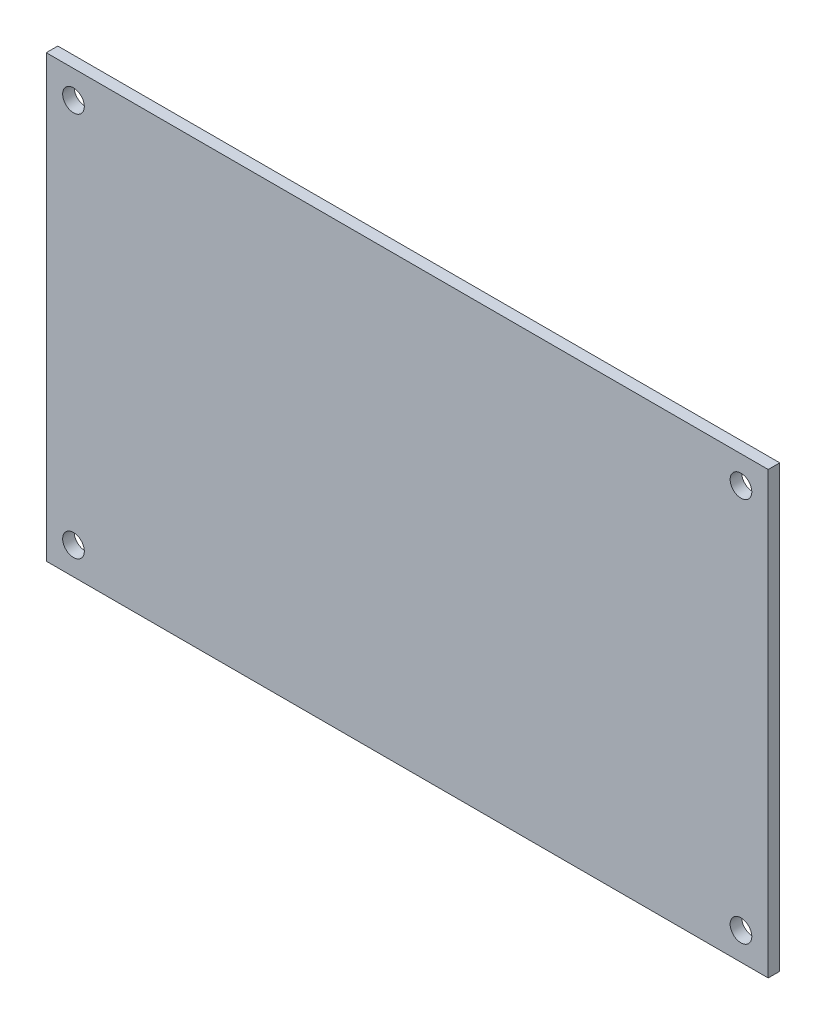
from build123d import *

# Parameters (mm, degrees)
SKETCH1_W           = 100
SKETCH1_H           = 61
SKETCH1_R           = 1.5
BOSS_EXTRUDE1_DEPTH = 1.6


with BuildPart() as part:
    # Sketch1 → Boss-Extrude1 (new body)
    with BuildSketch(Plane.XY):
        with Locations((50, 30.5)):
            Rectangle(SKETCH1_W, SKETCH1_H)
        with Locations((3.772, 3.83)):
            Circle(SKETCH1_R, mode=Mode.SUBTRACT)
        with Locations((96.228, 3.83)):
            Circle(SKETCH1_R, mode=Mode.SUBTRACT)
        with Locations((3.772, 57.17)):
            Circle(SKETCH1_R, mode=Mode.SUBTRACT)
        with Locations((96.228, 57.17)):
            Circle(SKETCH1_R, mode=Mode.SUBTRACT)
    extrude(amount=BOSS_EXTRUDE1_DEPTH)


solid = part.part
